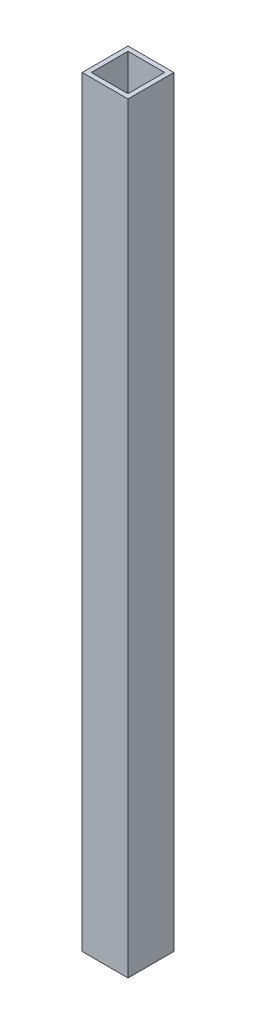
from build123d import *

# Parameters (mm, degrees)
SKETCH_1_W      = 10
SKETCH_1_H      = 10
SKETCH_1_W_2    = 8
SKETCH_1_H_2    = 8
EXTRUDE_1_DEPTH = 166


with BuildPart() as part:
    # 草图1 → 凸台-拉伸1 (new body)
    with BuildSketch(Plane(origin=(0, 0, 0), x_dir=(1, 0, 0), z_dir=(0, 1, 0))):
        Rectangle(SKETCH_1_W, SKETCH_1_H)
        Rectangle(SKETCH_1_W_2, SKETCH_1_H_2, mode=Mode.SUBTRACT)
    extrude(amount=EXTRUDE_1_DEPTH)


solid = part.part
